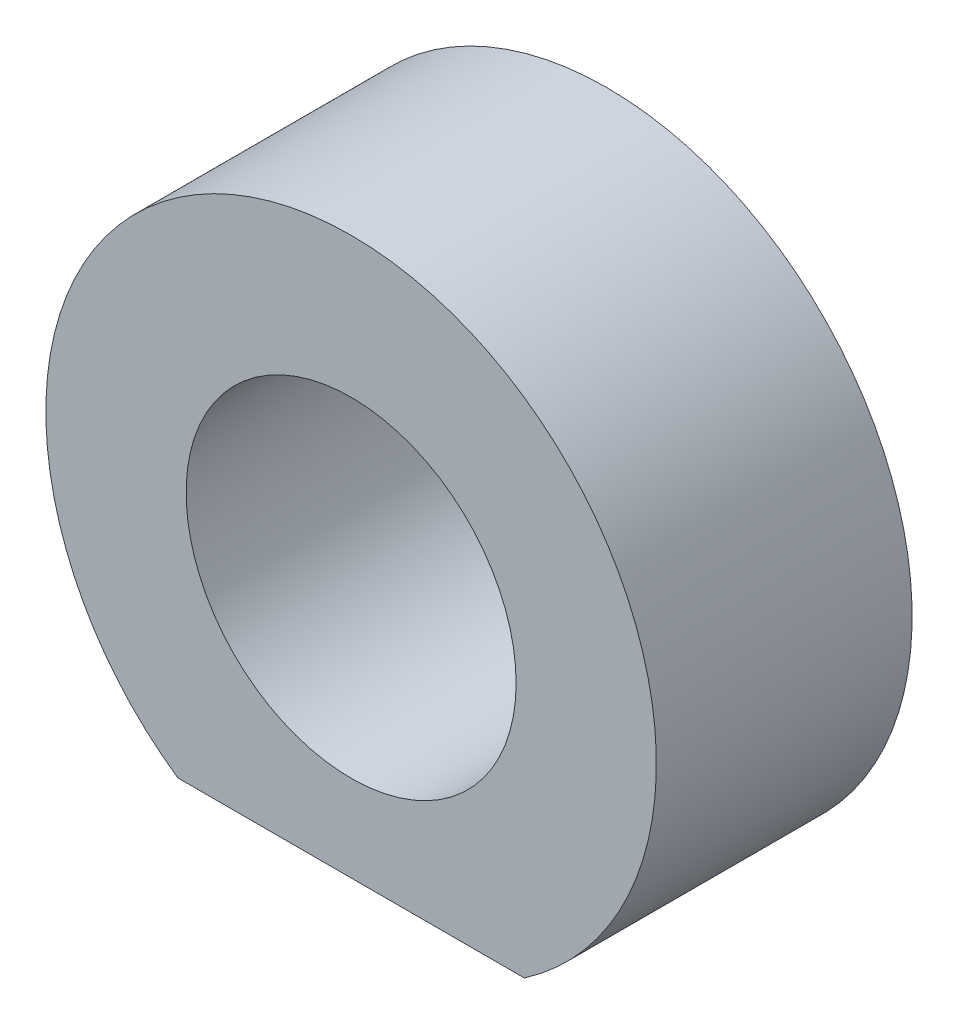
from build123d import *

# Parameters (mm, degrees)
IZIM1_R                     = 10
Y_KSEKLIK_EKSTR_ZYON1_DEPTH = 7.75


with BuildPart() as part:
    # Çizim1 → Yükseklik-Ekstrüzyon1 (new, symmetric)
    with BuildSketch(Plane.XY):
        with BuildLine():
            Line((-10.50009956, -15.231477579), (10.50009956, -15.231477579))
            ThreePointArc((10.50009956, -15.231477579), (0, 18.5), (-10.50009956, -15.231477579))
        make_face()
        Circle(IZIM1_R, mode=Mode.SUBTRACT)
    extrude(amount=Y_KSEKLIK_EKSTR_ZYON1_DEPTH, both=True)


solid = part.part
